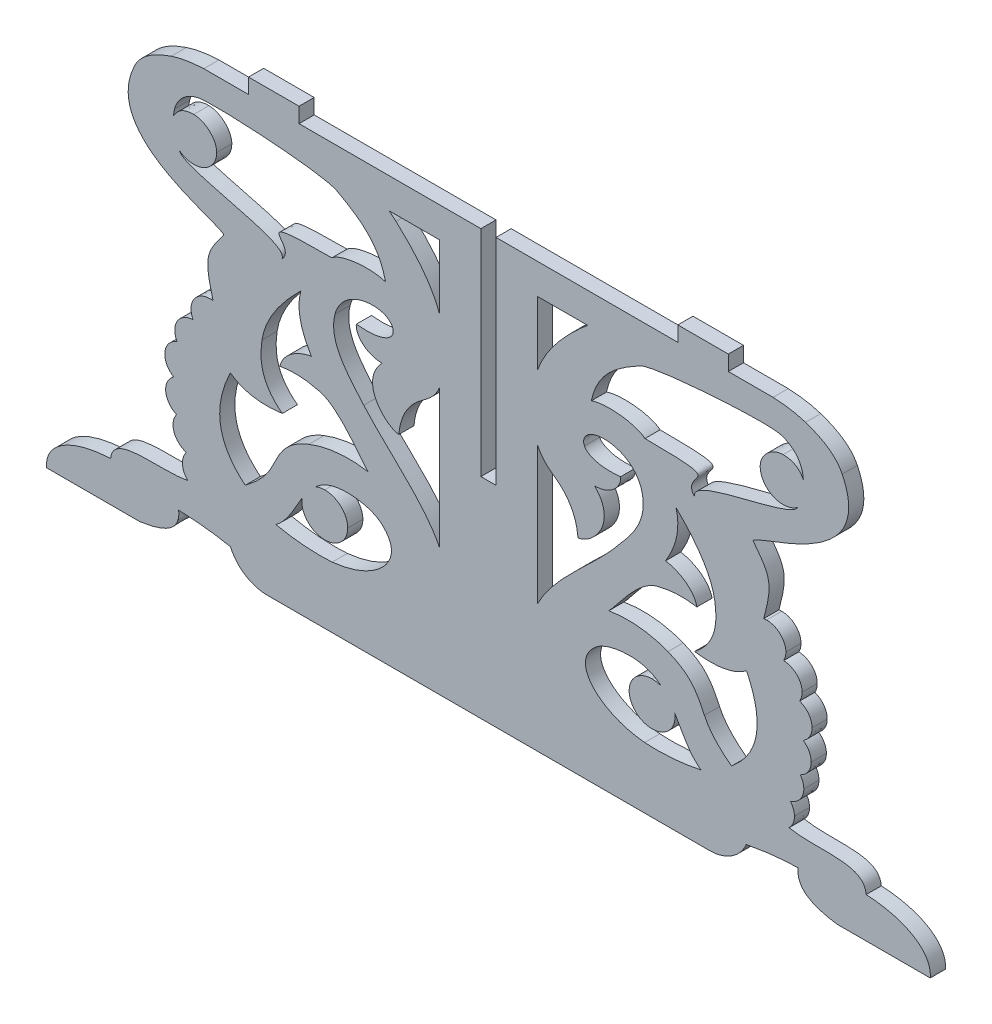
from build123d import *

# Parameters (mm, degrees)
RESSALTO_EXTRUS_O1_DEPTH = 2


with BuildPart() as part:
    # Model → Ressalto-extrusão1 (new body)
    with BuildSketch(Plane.XY):
        with BuildLine():
            Line((-58.0295, -71.5532), (-45.7155, -71.5532))
            add(Edge.make_bspline(
                [(-45.7155, -71.5532), (-42.3585, -71.0822), (-40.3248, -69.9761), (-40.6026, -67.6718)],
                knots=[0.327868852, 0.327868852, 0.327868852, 0.327868852, 0.344262295, 0.344262295, 0.344262295, 0.344262295], degree=3))
            add(Edge.make_bspline(
                [(-40.6026, -67.6718), (-37.8869, -67.763), (-35.6926, -68.0475), (-33.7519, -68.4372)],
                knots=[0.344262295, 0.344262295, 0.344262295, 0.344262295, 0.360655738, 0.360655738, 0.360655738, 0.360655738], degree=3))
            add(Edge.make_bspline(
                [(-33.7519, -68.4372), (-32.9718, -70.2591), (-31.0759, -71.5532), (-28.8751, -71.5532)],
                knots=[0.360655738, 0.360655738, 0.360655738, 0.360655738, 0.37704918, 0.37704918, 0.37704918, 0.37704918], degree=3))
            add(Edge.make_bspline(
                [(-28.8751, -71.5532), (-9.4317, -71.5532), (10.0118, -71.5532), (29.4553, -71.5532)],
                knots=[0.37704918, 0.37704918, 0.37704918, 0.37704918, 0.393442623, 0.393442623, 0.393442623, 0.393442623], degree=3))
            add(Edge.make_bspline(
                [(29.4553, -71.5532), (31.6561, -71.5532), (33.552, -70.2591), (34.3321, -68.4372)],
                knots=[0.393442623, 0.393442623, 0.393442623, 0.393442623, 0.409836066, 0.409836066, 0.409836066, 0.409836066], degree=3))
            add(Edge.make_bspline(
                [(34.3321, -68.4372), (36.2728, -68.0475), (38.4671, -67.763), (41.1827, -67.6718)],
                knots=[0.409836066, 0.409836066, 0.409836066, 0.409836066, 0.426229508, 0.426229508, 0.426229508, 0.426229508], degree=3))
            add(Edge.make_bspline(
                [(41.1827, -67.6718), (40.905, -69.9761), (42.9386, -71.0822), (46.2957, -71.5532)],
                knots=[0.426229508, 0.426229508, 0.426229508, 0.426229508, 0.442622951, 0.442622951, 0.442622951, 0.442622951], degree=3))
            Line((46.2957, -71.5532), (58.6097, -71.5532))
            add(Edge.make_bspline(
                [(58.6097, -71.5532), (58.8625, -68.7212), (55.5947, -66.5289), (50.1481, -66.2516)],
                knots=[0.459016393, 0.459016393, 0.459016393, 0.459016393, 0.475409836, 0.475409836, 0.475409836, 0.475409836], degree=3))
            add(Edge.make_bspline(
                [(50.1481, -66.2516), (49.8687, -62.8619), (43.6771, -64.4482), (39.976, -63.6903)],
                knots=[0.475409836, 0.475409836, 0.475409836, 0.475409836, 0.491803279, 0.491803279, 0.491803279, 0.491803279], degree=3))
            add(Edge.make_bspline(
                [(39.976, -63.6903), (40.4117, -63.2593), (40.6794, -62.6755), (40.6794, -62.0328)],
                knots=[0.491803279, 0.491803279, 0.491803279, 0.491803279, 0.508196721, 0.508196721, 0.508196721, 0.508196721], degree=3))
            add(Edge.make_bspline(
                [(40.6794, -62.0328), (40.6794, -61.4833), (40.4836, -60.9769), (40.1546, -60.5722)],
                knots=[0.508196721, 0.508196721, 0.508196721, 0.508196721, 0.524590164, 0.524590164, 0.524590164, 0.524590164], degree=3))
            add(Edge.make_bspline(
                [(40.1546, -60.5722), (41.1789, -60.2622), (41.9209, -59.3557), (41.9209, -58.2855)],
                knots=[0.524590164, 0.524590164, 0.524590164, 0.524590164, 0.540983607, 0.540983607, 0.540983607, 0.540983607], degree=3))
            add(Edge.make_bspline(
                [(41.9209, -58.2855), (41.9209, -57.7691), (41.748, -57.2907), (41.4541, -56.899)],
                knots=[0.540983607, 0.540983607, 0.540983607, 0.540983607, 0.557377049, 0.557377049, 0.557377049, 0.557377049], degree=3))
            add(Edge.make_bspline(
                [(41.4541, -56.899), (42.3085, -56.5121), (42.8989, -55.6878), (42.8989, -54.7333)],
                knots=[0.557377049, 0.557377049, 0.557377049, 0.557377049, 0.573770492, 0.573770492, 0.573770492, 0.573770492], degree=3))
            add(Edge.make_bspline(
                [(42.8989, -54.7333), (42.8989, -53.9284), (42.4789, -53.2156), (41.8349, -52.78)],
                knots=[0.573770492, 0.573770492, 0.573770492, 0.573770492, 0.590163934, 0.590163934, 0.590163934, 0.590163934], degree=3))
            add(Edge.make_bspline(
                [(41.8349, -52.78), (42.5423, -52.3535), (43.0118, -51.6062), (43.0118, -50.755)],
                knots=[0.590163934, 0.590163934, 0.590163934, 0.590163934, 0.606557377, 0.606557377, 0.606557377, 0.606557377], degree=3))
            add(Edge.make_bspline(
                [(43.0118, -50.755), (43.0118, -49.7306), (42.3319, -48.856), (41.3753, -48.5111)],
                knots=[0.606557377, 0.606557377, 0.606557377, 0.606557377, 0.62295082, 0.62295082, 0.62295082, 0.62295082], degree=3))
            add(Edge.make_bspline(
                [(41.3753, -48.5111), (41.5791, -48.1658), (41.6954, -47.7683), (41.6954, -47.3449)],
                knots=[0.62295082, 0.62295082, 0.62295082, 0.62295082, 0.639344262, 0.639344262, 0.639344262, 0.639344262], degree=3))
            add(Edge.make_bspline(
                [(41.6954, -47.3449), (41.6954, -46.0535), (40.6149, -44.9999), (39.2612, -44.9462)],
                knots=[0.639344262, 0.639344262, 0.639344262, 0.639344262, 0.655737705, 0.655737705, 0.655737705, 0.655737705], degree=3))
            add(Edge.make_bspline(
                [(39.2612, -44.9462), (39.447, -44.6128), (39.5524, -44.2332), (39.5524, -43.8303)],
                knots=[0.655737705, 0.655737705, 0.655737705, 0.655737705, 0.672131148, 0.672131148, 0.672131148, 0.672131148], degree=3))
            add(Edge.make_bspline(
                [(39.5524, -43.8303), (39.5524, -42.5045), (38.4138, -41.4292), (37.0097, -41.4292)],
                knots=[0.672131148, 0.672131148, 0.672131148, 0.672131148, 0.68852459, 0.68852459, 0.68852459, 0.68852459], degree=3))
            add(Edge.make_bspline(
                [(37.0097, -41.4292), (36.8829, -41.4292), (36.7582, -41.4381), (36.6363, -41.4551)],
                knots=[0.68852459, 0.68852459, 0.68852459, 0.68852459, 0.704918033, 0.704918033, 0.704918033, 0.704918033], degree=3))
            add(Edge.make_bspline(
                [(36.6363, -41.4551), (37.8897, -36.8147), (37.477, -36.2087), (35.2126, -33.2356)],
                knots=[0.704918033, 0.704918033, 0.704918033, 0.704918033, 0.721311475, 0.721311475, 0.721311475, 0.721311475], degree=3))
            add(Edge.make_bspline(
                [(35.2126, -33.2356), (36.2749, -31.9971), (51.5777, -29.2085), (46.9881, -19.7647)],
                knots=[0.721311475, 0.721311475, 0.721311475, 0.721311475, 0.737704918, 0.737704918, 0.737704918, 0.737704918], degree=3))
            add(Edge.make_bspline(
                [(46.9881, -19.7647), (46.322, -18.394), (44.8758, -17.1731), (42.1528, -16.2641)],
                knots=[0.737704918, 0.737704918, 0.737704918, 0.737704918, 0.754098361, 0.754098361, 0.754098361, 0.754098361], degree=3))
            add(Edge.make_bspline(
                [(42.1528, -16.2641), (40.9147, -15.8508), (39.4354, -15.6137), (37.859, -15.5493)],
                knots=[0.754098361, 0.754098361, 0.754098361, 0.754098361, 0.770491803, 0.770491803, 0.770491803, 0.770491803], degree=3))
            Line((37.859, -15.5493), (31.9567, -15.5493))
            Line((31.9567, -15.5493), (31.9567, -13.5542))
            Line((31.9567, -13.5542), (25.2901, -13.5542))
            Line((25.2901, -13.5542), (25.2901, -15.5493))
            Line((25.2901, -15.5493), (1.2901, -15.5493))
            Line((1.2901, -15.5493), (1.2901, -43.8921))
            Line((1.2901, -43.8921), (-0.7099, -43.8921))
            Line((-0.7099, -43.8921), (-0.7099, -15.5493))
            Line((-0.7099, -15.5493), (-24.7099, -15.5493))
            Line((-24.7099, -15.5493), (-24.7099, -13.5542))
            Line((-24.7099, -13.5542), (-31.3766, -13.5542))
            Line((-31.3766, -13.5542), (-31.3766, -15.5493))
            Line((-31.3766, -15.5493), (-37.2789, -15.5493))
            add(Edge.make_bspline(
                [(-37.2789, -15.5493), (-38.8553, -15.6137), (-40.3345, -15.8508), (-41.5726, -16.2641)],
                knots=[0, 0, 0, 0, 0.016393443, 0.016393443, 0.016393443, 0.016393443], degree=3))
            add(Edge.make_bspline(
                [(-41.5726, -16.2641), (-44.2957, -17.1731), (-45.7419, -18.394), (-46.408, -19.7647)],
                knots=[0.016393443, 0.016393443, 0.016393443, 0.016393443, 0.032786885, 0.032786885, 0.032786885, 0.032786885], degree=3))
            add(Edge.make_bspline(
                [(-46.408, -19.7647), (-50.9976, -29.2085), (-35.6947, -31.9971), (-34.6325, -33.2356)],
                knots=[0.032786885, 0.032786885, 0.032786885, 0.032786885, 0.049180328, 0.049180328, 0.049180328, 0.049180328], degree=3))
            add(Edge.make_bspline(
                [(-34.6325, -33.2356), (-36.8968, -36.2087), (-37.3095, -36.8147), (-36.0561, -41.4551)],
                knots=[0.049180328, 0.049180328, 0.049180328, 0.049180328, 0.06557377, 0.06557377, 0.06557377, 0.06557377], degree=3))
            add(Edge.make_bspline(
                [(-36.0561, -41.4551), (-36.178, -41.4381), (-36.3027, -41.4292), (-36.4296, -41.4292)],
                knots=[0.06557377, 0.06557377, 0.06557377, 0.06557377, 0.081967213, 0.081967213, 0.081967213, 0.081967213], degree=3))
            add(Edge.make_bspline(
                [(-36.4296, -41.4292), (-37.8337, -41.4292), (-38.9723, -42.5045), (-38.9723, -43.8303)],
                knots=[0.081967213, 0.081967213, 0.081967213, 0.081967213, 0.098360656, 0.098360656, 0.098360656, 0.098360656], degree=3))
            add(Edge.make_bspline(
                [(-38.9723, -43.8303), (-38.9723, -44.2332), (-38.8669, -44.6128), (-38.681, -44.9462)],
                knots=[0.098360656, 0.098360656, 0.098360656, 0.098360656, 0.114754098, 0.114754098, 0.114754098, 0.114754098], degree=3))
            add(Edge.make_bspline(
                [(-38.681, -44.9462), (-40.0347, -44.9999), (-41.1152, -46.0535), (-41.1152, -47.3449)],
                knots=[0.114754098, 0.114754098, 0.114754098, 0.114754098, 0.131147541, 0.131147541, 0.131147541, 0.131147541], degree=3))
            add(Edge.make_bspline(
                [(-41.1152, -47.3449), (-41.1152, -47.7683), (-40.9989, -48.1658), (-40.7951, -48.5111)],
                knots=[0.131147541, 0.131147541, 0.131147541, 0.131147541, 0.147540984, 0.147540984, 0.147540984, 0.147540984], degree=3))
            add(Edge.make_bspline(
                [(-40.7951, -48.5111), (-41.7518, -48.856), (-42.4316, -49.7306), (-42.4316, -50.755)],
                knots=[0.147540984, 0.147540984, 0.147540984, 0.147540984, 0.163934426, 0.163934426, 0.163934426, 0.163934426], degree=3))
            add(Edge.make_bspline(
                [(-42.4316, -50.755), (-42.4316, -51.6062), (-41.9621, -52.3535), (-41.2547, -52.78)],
                knots=[0.163934426, 0.163934426, 0.163934426, 0.163934426, 0.180327869, 0.180327869, 0.180327869, 0.180327869], degree=3))
            add(Edge.make_bspline(
                [(-41.2547, -52.78), (-41.8988, -53.2156), (-42.3188, -53.9284), (-42.3188, -54.7333)],
                knots=[0.180327869, 0.180327869, 0.180327869, 0.180327869, 0.196721311, 0.196721311, 0.196721311, 0.196721311], degree=3))
            add(Edge.make_bspline(
                [(-42.3188, -54.7333), (-42.3188, -55.6878), (-41.7284, -56.5121), (-40.874, -56.899)],
                knots=[0.196721311, 0.196721311, 0.196721311, 0.196721311, 0.213114754, 0.213114754, 0.213114754, 0.213114754], degree=3))
            add(Edge.make_bspline(
                [(-40.874, -56.899), (-41.1678, -57.2907), (-41.3407, -57.7691), (-41.3407, -58.2855)],
                knots=[0.213114754, 0.213114754, 0.213114754, 0.213114754, 0.229508197, 0.229508197, 0.229508197, 0.229508197], degree=3))
            add(Edge.make_bspline(
                [(-41.3407, -58.2855), (-41.3407, -59.3557), (-40.5988, -60.2622), (-39.5745, -60.5722)],
                knots=[0.229508197, 0.229508197, 0.229508197, 0.229508197, 0.245901639, 0.245901639, 0.245901639, 0.245901639], degree=3))
            add(Edge.make_bspline(
                [(-39.5745, -60.5722), (-39.9035, -60.9769), (-40.0993, -61.4833), (-40.0993, -62.0328)],
                knots=[0.245901639, 0.245901639, 0.245901639, 0.245901639, 0.262295082, 0.262295082, 0.262295082, 0.262295082], degree=3))
            add(Edge.make_bspline(
                [(-40.0993, -62.0328), (-40.0993, -62.6755), (-39.8315, -63.2593), (-39.3959, -63.6903)],
                knots=[0.262295082, 0.262295082, 0.262295082, 0.262295082, 0.278688525, 0.278688525, 0.278688525, 0.278688525], degree=3))
            add(Edge.make_bspline(
                [(-39.3959, -63.6903), (-43.0969, -64.4482), (-49.2885, -62.8619), (-49.5679, -66.2516)],
                knots=[0.278688525, 0.278688525, 0.278688525, 0.278688525, 0.295081967, 0.295081967, 0.295081967, 0.295081967], degree=3))
            add(Edge.make_bspline(
                [(-49.5679, -66.2516), (-55.0145, -66.5289), (-58.2823, -68.7212), (-58.0295, -71.5532)],
                knots=[0.295081967, 0.295081967, 0.295081967, 0.295081967, 0.31147541, 0.31147541, 0.31147541, 0.31147541], degree=3))
        make_face()
        with BuildLine():
            Line((41.8464, -22.9309), (41.8509, -22.9067))
            add(Edge.make_bspline(
                [(41.8509, -22.9067), (41.8313, -22.6217), (41.7887, -22.3443), (41.7202, -22.0779)],
                knots=[0.357142857, 0.357142857, 0.357142857, 0.357142857, 0.428571429, 0.428571429, 0.428571429, 0.428571429], degree=3))
            add(Edge.make_bspline(
                [(41.7202, -22.0779), (41.4272, -20.9402), (40.448, -19.6292), (38.5962, -19.2465)],
                knots=[0.428571429, 0.428571429, 0.428571429, 0.428571429, 0.5, 0.5, 0.5, 0.5], degree=3))
            add(Edge.make_bspline(
                [(38.5962, -19.2465), (36.406, -18.7935), (22.1887, -19.664), (20.2699, -20.7424)],
                knots=[0.5, 0.5, 0.5, 0.5, 0.571428571, 0.571428571, 0.571428571, 0.571428571], degree=3))
            add(Edge.make_bspline(
                [(20.2699, -20.7424), (17.8156, -22.1218), (14.7391, -23.8156), (13.8733, -27.9378)],
                knots=[0.571428571, 0.571428571, 0.571428571, 0.571428571, 0.642857143, 0.642857143, 0.642857143, 0.642857143], degree=3))
            add(Edge.make_bspline(
                [(13.8733, -27.9378), (15.6554, -27.278), (19.6405, -27.5829), (20.951, -28.7164)],
                knots=[0.642857143, 0.642857143, 0.642857143, 0.642857143, 0.714285714, 0.714285714, 0.714285714, 0.714285714], degree=3))
            add(Edge.make_bspline(
                [(20.951, -28.7164), (32.8615, -28.7164), (25.4889, -29.6957), (27.4601, -32.0549)],
                knots=[0.714285714, 0.714285714, 0.714285714, 0.714285714, 0.785714286, 0.785714286, 0.785714286, 0.785714286], degree=3))
            Line((27.4601, -32.0549), (27.5114, -32.0551))
            add(Edge.make_bspline(
                [(27.5114, -32.0551), (26.8882, -29.8021), (40.2299, -28.4327), (41.0991, -26.5055)],
                knots=[0.857142857, 0.857142857, 0.857142857, 0.857142857, 1, 1, 1, 1], degree=3))
            add(Edge.make_bspline(
                [(41.0991, -26.5055), (40.5779, -26.9077), (39.9123, -27.1488), (39.1869, -27.1489)],
                knots=[0, 0, 0, 0, 0.071428571, 0.071428571, 0.071428571, 0.071428571], degree=3))
            add(Edge.make_bspline(
                [(39.1869, -27.1489), (37.5166, -27.1488), (36.162, -25.8701), (36.162, -24.2928)],
                knots=[0.071428571, 0.071428571, 0.071428571, 0.071428571, 0.142857143, 0.142857143, 0.142857143, 0.142857143], degree=3))
            add(Edge.make_bspline(
                [(36.162, -24.2928), (36.162, -22.7154), (37.7777, -21.4359), (39.1869, -21.4359)],
                knots=[0.142857143, 0.142857143, 0.142857143, 0.142857143, 0.214285714, 0.214285714, 0.214285714, 0.214285714], degree=3))
            add(Edge.make_bspline(
                [(39.1869, -21.4359), (40.5962, -21.4359), (41.3341, -22.0405), (41.8464, -22.9309)],
                knots=[0.214285714, 0.214285714, 0.214285714, 0.214285714, 0.285714286, 0.285714286, 0.285714286, 0.285714286], degree=3))
        make_face(mode=Mode.SUBTRACT)
        with BuildLine():
            Line((6.7678, -54.6917), (6.7678, -36.4907))
            add(Edge.make_bspline(
                [(6.7678, -36.4907), (7.1177, -37.3515), (7.7821, -38.1712), (8.8217, -38.8882)],
                knots=[0.083333333, 0.083333333, 0.083333333, 0.083333333, 0.166666667, 0.166666667, 0.166666667, 0.166666667], degree=3))
            add(Edge.make_bspline(
                [(8.8217, -38.8882), (10.4062, -39.9811), (11.8709, -41.6153), (12.1135, -44.4942)],
                knots=[0.166666667, 0.166666667, 0.166666667, 0.166666667, 0.25, 0.25, 0.25, 0.25], degree=3))
            add(Edge.make_bspline(
                [(12.1135, -44.4942), (14.0789, -44.2506), (17.4305, -40.5964), (14.3074, -37.4419)],
                knots=[0.25, 0.25, 0.25, 0.25, 0.333333333, 0.333333333, 0.333333333, 0.333333333], degree=3))
            add(Edge.make_bspline(
                [(14.3074, -37.4419), (16.2667, -37.4909), (17.8601, -36.0383), (17.7312, -34.6895)],
                knots=[0.333333333, 0.333333333, 0.333333333, 0.333333333, 0.416666667, 0.416666667, 0.416666667, 0.416666667], degree=3))
            add(Edge.make_bspline(
                [(17.7312, -34.6895), (14.9058, -34.9858), (13.3648, -34.3445), (12.9675, -33.5507)],
                knots=[0.416666667, 0.416666667, 0.416666667, 0.416666667, 0.5, 0.5, 0.5, 0.5], degree=3))
            add(Edge.make_bspline(
                [(12.9675, -33.5507), (12.7751, -33.1662), (12.8359, -32.7459), (13.1165, -32.3713)],
                knots=[0.5, 0.5, 0.5, 0.5, 0.583333333, 0.583333333, 0.583333333, 0.583333333], degree=3))
            add(Edge.make_bspline(
                [(13.1165, -32.3713), (13.9625, -31.2424), (16.199, -31.233), (17.7583, -31.8726)],
                knots=[0.583333333, 0.583333333, 0.583333333, 0.583333333, 0.666666667, 0.666666667, 0.666666667, 0.666666667], degree=3))
            add(Edge.make_bspline(
                [(17.7583, -31.8726), (19.301, -32.5053), (20.2207, -33.6838), (20.5427, -34.9484)],
                knots=[0.666666667, 0.666666667, 0.666666667, 0.666666667, 0.75, 0.75, 0.75, 0.75], degree=3))
            add(Edge.make_bspline(
                [(20.5427, -34.9484), (21.4025, -38.3248), (19.0104, -40.8664), (16.7475, -43.4634)],
                knots=[0.75, 0.75, 0.75, 0.75, 0.833333333, 0.833333333, 0.833333333, 0.833333333], degree=3))
            add(Edge.make_bspline(
                [(16.7475, -43.4634), (13.6063, -47.0685), (8.8067, -50.5847), (6.7678, -54.6917)],
                knots=[0.833333333, 0.833333333, 0.833333333, 0.833333333, 1, 1, 1, 1], degree=3))
        make_face(mode=Mode.SUBTRACT)
        with BuildLine():
            Line((25.2636, -34.7621), (25.2605, -34.7639))
            Line((25.2605, -34.7639), (25.2233, -34.7226))
            add(Edge.make_bspline(
                [(25.2233, -34.7226), (25.1662, -34.6668), (25.1087, -34.611), (25.0509, -34.555)],
                knots=[0.133333333, 0.133333333, 0.133333333, 0.133333333, 0.2, 0.2, 0.2, 0.2], degree=3))
            add(Edge.make_bspline(
                [(25.0509, -34.555), (25.6852, -36.9016), (25.0055, -39.1271), (23.6733, -41.332)],
                knots=[0.2, 0.2, 0.2, 0.2, 0.266666667, 0.266666667, 0.266666667, 0.266666667], degree=3))
            add(Edge.make_bspline(
                [(23.6733, -41.332), (25.5011, -41.6329), (27.4577, -42.8346), (27.8065, -44.5414)],
                knots=[0.266666667, 0.266666667, 0.266666667, 0.266666667, 0.333333333, 0.333333333, 0.333333333, 0.333333333], degree=3))
            add(Edge.make_bspline(
                [(27.8065, -44.5414), (26.0758, -44.234), (24.4417, -44.3248), (22.61, -44.7856)],
                knots=[0.333333333, 0.333333333, 0.333333333, 0.333333333, 0.4, 0.4, 0.4, 0.4], degree=3))
            add(Edge.make_bspline(
                [(22.61, -44.7856), (19.945, -45.4561), (17.4208, -49.5455), (16.1735, -50.7932)],
                knots=[0.4, 0.4, 0.4, 0.4, 0.466666667, 0.466666667, 0.466666667, 0.466666667], degree=3))
            add(Edge.make_bspline(
                [(16.1735, -50.7932), (19.0564, -50.2753), (21.8473, -50.7043), (23.993, -51.5534)],
                knots=[0.466666667, 0.466666667, 0.466666667, 0.466666667, 0.533333333, 0.533333333, 0.533333333, 0.533333333], degree=3))
            add(Edge.make_bspline(
                [(23.993, -51.5534), (27.0207, -52.7513), (27.8131, -54.3528), (28.7997, -56.4207)],
                knots=[0.533333333, 0.533333333, 0.533333333, 0.533333333, 0.6, 0.6, 0.6, 0.6], degree=3))
            add(Edge.make_bspline(
                [(28.7997, -56.4207), (29.3141, -57.4989), (30.133, -58.7455), (32.3886, -60.4342)],
                knots=[0.6, 0.6, 0.6, 0.6, 0.666666667, 0.666666667, 0.666666667, 0.666666667], degree=3))
            add(Edge.make_bspline(
                [(32.3886, -60.4342), (35.742, -57.6622), (36.9574, -53.9478), (34.3619, -48.5537)],
                knots=[0.666666667, 0.666666667, 0.666666667, 0.666666667, 0.733333333, 0.733333333, 0.733333333, 0.733333333], degree=3))
            add(Edge.make_bspline(
                [(34.3619, -48.5537), (32.6868, -49.8379), (30.2026, -50.1725), (27.4986, -49.7829)],
                knots=[0.733333333, 0.733333333, 0.733333333, 0.733333333, 0.8, 0.8, 0.8, 0.8], degree=3))
            add(Edge.make_bspline(
                [(27.4986, -49.7829), (30.2732, -47.6893), (30.5616, -45.1772), (30.1795, -42.7182)],
                knots=[0.8, 0.8, 0.8, 0.8, 0.866666667, 0.866666667, 0.866666667, 0.866666667], degree=3))
            add(Edge.make_bspline(
                [(30.1795, -42.7182), (29.7867, -40.1904), (28.096, -37.5453), (25.2636, -34.7621)],
                knots=[0.866666667, 0.866666667, 0.866666667, 0.866666667, 1, 1, 1, 1], degree=3))
        make_face(mode=Mode.SUBTRACT)
        with BuildLine():
            Line((6.7678, -27.9915), (6.7678, -19.5605))
            Line((6.7678, -19.5605), (13.3925, -19.5605))
            add(Edge.make_bspline(
                [(13.3925, -19.5605), (13.0822, -19.8065), (12.7813, -20.0607), (12.4899, -20.3228)],
                knots=[0.4, 0.4, 0.4, 0.4, 0.6, 0.6, 0.6, 0.6], degree=3))
            add(Edge.make_bspline(
                [(12.4899, -20.3228), (9.9255, -22.6296), (7.6953, -25.2917), (6.7678, -27.9915)],
                knots=[0.6, 0.6, 0.6, 0.6, 1, 1, 1, 1], degree=3))
        make_face(mode=Mode.SUBTRACT)
        with BuildLine():
            Line((-41.2663, -22.9309), (-41.2707, -22.9067))
            add(Edge.make_bspline(
                [(-41.2707, -22.9067), (-41.2511, -22.6217), (-41.2086, -22.3443), (-41.14, -22.0779)],
                knots=[0.357142857, 0.357142857, 0.357142857, 0.357142857, 0.428571429, 0.428571429, 0.428571429, 0.428571429], degree=3))
            add(Edge.make_bspline(
                [(-41.14, -22.0779), (-40.847, -20.9402), (-39.8679, -19.6292), (-38.0161, -19.2465)],
                knots=[0.428571429, 0.428571429, 0.428571429, 0.428571429, 0.5, 0.5, 0.5, 0.5], degree=3))
            add(Edge.make_bspline(
                [(-38.0161, -19.2465), (-35.8259, -18.7935), (-21.6086, -19.664), (-19.6898, -20.7424)],
                knots=[0.5, 0.5, 0.5, 0.5, 0.571428571, 0.571428571, 0.571428571, 0.571428571], degree=3))
            add(Edge.make_bspline(
                [(-19.6898, -20.7424), (-17.2355, -22.1218), (-14.1589, -23.8156), (-13.2931, -27.9378)],
                knots=[0.571428571, 0.571428571, 0.571428571, 0.571428571, 0.642857143, 0.642857143, 0.642857143, 0.642857143], degree=3))
            add(Edge.make_bspline(
                [(-13.2931, -27.9378), (-15.0753, -27.278), (-19.0603, -27.5829), (-20.3708, -28.7164)],
                knots=[0.642857143, 0.642857143, 0.642857143, 0.642857143, 0.714285714, 0.714285714, 0.714285714, 0.714285714], degree=3))
            add(Edge.make_bspline(
                [(-20.3708, -28.7164), (-32.2813, -28.7164), (-24.9088, -29.6957), (-26.8799, -32.0549)],
                knots=[0.714285714, 0.714285714, 0.714285714, 0.714285714, 0.785714286, 0.785714286, 0.785714286, 0.785714286], degree=3))
            Line((-26.8799, -32.0549), (-26.9313, -32.0551))
            add(Edge.make_bspline(
                [(-26.9313, -32.0551), (-26.308, -29.8021), (-39.6497, -28.4327), (-40.5189, -26.5055)],
                knots=[0.857142857, 0.857142857, 0.857142857, 0.857142857, 1, 1, 1, 1], degree=3))
            add(Edge.make_bspline(
                [(-40.5189, -26.5055), (-39.9977, -26.9077), (-39.3321, -27.1488), (-38.6068, -27.1489)],
                knots=[0, 0, 0, 0, 0.071428571, 0.071428571, 0.071428571, 0.071428571], degree=3))
            add(Edge.make_bspline(
                [(-38.6068, -27.1489), (-36.9365, -27.1488), (-35.5819, -25.8701), (-35.5819, -24.2928)],
                knots=[0.071428571, 0.071428571, 0.071428571, 0.071428571, 0.142857143, 0.142857143, 0.142857143, 0.142857143], degree=3))
            add(Edge.make_bspline(
                [(-35.5819, -24.2928), (-35.5819, -22.7154), (-37.1975, -21.4359), (-38.6068, -21.4359)],
                knots=[0.142857143, 0.142857143, 0.142857143, 0.142857143, 0.214285714, 0.214285714, 0.214285714, 0.214285714], degree=3))
            add(Edge.make_bspline(
                [(-38.6068, -21.4359), (-40.016, -21.4359), (-40.754, -22.0405), (-41.2663, -22.9309)],
                knots=[0.214285714, 0.214285714, 0.214285714, 0.214285714, 0.285714286, 0.285714286, 0.285714286, 0.285714286], degree=3))
        make_face(mode=Mode.SUBTRACT)
        with BuildLine():
            Line((-6.1877, -54.6917), (-6.1877, -36.4907))
            add(Edge.make_bspline(
                [(-6.1877, -36.4907), (-6.5375, -37.3515), (-7.202, -38.1712), (-8.2415, -38.8882)],
                knots=[0.083333333, 0.083333333, 0.083333333, 0.083333333, 0.166666667, 0.166666667, 0.166666667, 0.166666667], degree=3))
            add(Edge.make_bspline(
                [(-8.2415, -38.8882), (-9.826, -39.9811), (-11.2907, -41.6153), (-11.5334, -44.4942)],
                knots=[0.166666667, 0.166666667, 0.166666667, 0.166666667, 0.25, 0.25, 0.25, 0.25], degree=3))
            add(Edge.make_bspline(
                [(-11.5334, -44.4942), (-13.4988, -44.2506), (-16.8504, -40.5964), (-13.7272, -37.4419)],
                knots=[0.25, 0.25, 0.25, 0.25, 0.333333333, 0.333333333, 0.333333333, 0.333333333], degree=3))
            add(Edge.make_bspline(
                [(-13.7272, -37.4419), (-15.6865, -37.4909), (-17.2799, -36.0383), (-17.151, -34.6895)],
                knots=[0.333333333, 0.333333333, 0.333333333, 0.333333333, 0.416666667, 0.416666667, 0.416666667, 0.416666667], degree=3))
            add(Edge.make_bspline(
                [(-17.151, -34.6895), (-14.3257, -34.9858), (-12.7846, -34.3445), (-12.3874, -33.5507)],
                knots=[0.416666667, 0.416666667, 0.416666667, 0.416666667, 0.5, 0.5, 0.5, 0.5], degree=3))
            add(Edge.make_bspline(
                [(-12.3874, -33.5507), (-12.195, -33.1662), (-12.2557, -32.7459), (-12.5364, -32.3713)],
                knots=[0.5, 0.5, 0.5, 0.5, 0.583333333, 0.583333333, 0.583333333, 0.583333333], degree=3))
            add(Edge.make_bspline(
                [(-12.5364, -32.3713), (-13.3823, -31.2424), (-15.6188, -31.233), (-17.1782, -31.8726)],
                knots=[0.583333333, 0.583333333, 0.583333333, 0.583333333, 0.666666667, 0.666666667, 0.666666667, 0.666666667], degree=3))
            add(Edge.make_bspline(
                [(-17.1782, -31.8726), (-18.7209, -32.5053), (-19.6406, -33.6838), (-19.9625, -34.9484)],
                knots=[0.666666667, 0.666666667, 0.666666667, 0.666666667, 0.75, 0.75, 0.75, 0.75], degree=3))
            add(Edge.make_bspline(
                [(-19.9625, -34.9484), (-20.8224, -38.3248), (-18.4302, -40.8664), (-16.1674, -43.4634)],
                knots=[0.75, 0.75, 0.75, 0.75, 0.833333333, 0.833333333, 0.833333333, 0.833333333], degree=3))
            add(Edge.make_bspline(
                [(-16.1674, -43.4634), (-13.0261, -47.0685), (-8.2265, -50.5847), (-6.1877, -54.6917)],
                knots=[0.833333333, 0.833333333, 0.833333333, 0.833333333, 1, 1, 1, 1], degree=3))
        make_face(mode=Mode.SUBTRACT)
        with BuildLine():
            Line((-24.6834, -34.7621), (-24.6804, -34.7639))
            Line((-24.6804, -34.7639), (-24.6431, -34.7226))
            add(Edge.make_bspline(
                [(-24.6431, -34.7226), (-24.5861, -34.6668), (-24.5286, -34.611), (-24.4707, -34.555)],
                knots=[0.133333333, 0.133333333, 0.133333333, 0.133333333, 0.2, 0.2, 0.2, 0.2], degree=3))
            add(Edge.make_bspline(
                [(-24.4707, -34.555), (-25.105, -36.9016), (-24.4253, -39.1271), (-23.0931, -41.332)],
                knots=[0.2, 0.2, 0.2, 0.2, 0.266666667, 0.266666667, 0.266666667, 0.266666667], degree=3))
            add(Edge.make_bspline(
                [(-23.0931, -41.332), (-24.921, -41.6329), (-26.8776, -42.8346), (-27.2264, -44.5414)],
                knots=[0.266666667, 0.266666667, 0.266666667, 0.266666667, 0.333333333, 0.333333333, 0.333333333, 0.333333333], degree=3))
            add(Edge.make_bspline(
                [(-27.2264, -44.5414), (-25.4957, -44.234), (-23.8615, -44.3248), (-22.0299, -44.7856)],
                knots=[0.333333333, 0.333333333, 0.333333333, 0.333333333, 0.4, 0.4, 0.4, 0.4], degree=3))
            add(Edge.make_bspline(
                [(-22.0299, -44.7856), (-19.3648, -45.4561), (-16.8406, -49.5455), (-15.5933, -50.7932)],
                knots=[0.4, 0.4, 0.4, 0.4, 0.466666667, 0.466666667, 0.466666667, 0.466666667], degree=3))
            add(Edge.make_bspline(
                [(-15.5933, -50.7932), (-18.4762, -50.2753), (-21.2671, -50.7043), (-23.4129, -51.5534)],
                knots=[0.466666667, 0.466666667, 0.466666667, 0.466666667, 0.533333333, 0.533333333, 0.533333333, 0.533333333], degree=3))
            add(Edge.make_bspline(
                [(-23.4129, -51.5534), (-26.4406, -52.7513), (-27.233, -54.3528), (-28.2196, -56.4207)],
                knots=[0.533333333, 0.533333333, 0.533333333, 0.533333333, 0.6, 0.6, 0.6, 0.6], degree=3))
            add(Edge.make_bspline(
                [(-28.2196, -56.4207), (-28.734, -57.4989), (-29.5528, -58.7455), (-31.8084, -60.4342)],
                knots=[0.6, 0.6, 0.6, 0.6, 0.666666667, 0.666666667, 0.666666667, 0.666666667], degree=3))
            add(Edge.make_bspline(
                [(-31.8084, -60.4342), (-35.1618, -57.6622), (-36.3773, -53.9478), (-33.7818, -48.5537)],
                knots=[0.666666667, 0.666666667, 0.666666667, 0.666666667, 0.733333333, 0.733333333, 0.733333333, 0.733333333], degree=3))
            add(Edge.make_bspline(
                [(-33.7818, -48.5537), (-32.1066, -49.8379), (-29.6224, -50.1725), (-26.9184, -49.7829)],
                knots=[0.733333333, 0.733333333, 0.733333333, 0.733333333, 0.8, 0.8, 0.8, 0.8], degree=3))
            add(Edge.make_bspline(
                [(-26.9184, -49.7829), (-29.693, -47.6893), (-29.9814, -45.1772), (-29.5994, -42.7182)],
                knots=[0.8, 0.8, 0.8, 0.8, 0.866666667, 0.866666667, 0.866666667, 0.866666667], degree=3))
            add(Edge.make_bspline(
                [(-29.5994, -42.7182), (-29.2066, -40.1904), (-27.5159, -37.5453), (-24.6834, -34.7621)],
                knots=[0.866666667, 0.866666667, 0.866666667, 0.866666667, 1, 1, 1, 1], degree=3))
        make_face(mode=Mode.SUBTRACT)
        with BuildLine():
            Line((-6.1877, -27.9915), (-6.1877, -19.5605))
            Line((-6.1877, -19.5605), (-12.8123, -19.5605))
            add(Edge.make_bspline(
                [(-12.8123, -19.5605), (-12.5021, -19.8065), (-12.2011, -20.0607), (-11.9097, -20.3228)],
                knots=[0.4, 0.4, 0.4, 0.4, 0.6, 0.6, 0.6, 0.6], degree=3))
            add(Edge.make_bspline(
                [(-11.9097, -20.3228), (-9.3454, -22.6296), (-7.1151, -25.2917), (-6.1877, -27.9915)],
                knots=[0.6, 0.6, 0.6, 0.6, 1, 1, 1, 1], degree=3))
        make_face(mode=Mode.SUBTRACT)
        with BuildLine():
            add(Edge.make_bspline(
                [(21.8901, -55.715), (20.2198, -55.715), (18.8652, -56.9943), (18.8652, -58.5718)],
                knots=[0, 0, 0, 0, 0.090909091, 0.090909091, 0.090909091, 0.090909091], degree=3))
            add(Edge.make_bspline(
                [(18.8652, -58.5718), (18.8652, -60.1489), (20.2198, -61.4279), (21.8901, -61.4279)],
                knots=[0.090909091, 0.090909091, 0.090909091, 0.090909091, 0.181818182, 0.181818182, 0.181818182, 0.181818182], degree=3))
            add(Edge.make_bspline(
                [(21.8901, -61.4279), (23.5605, -61.4279), (24.915, -60.1489), (24.915, -58.5718)],
                knots=[0.181818182, 0.181818182, 0.181818182, 0.181818182, 0.272727273, 0.272727273, 0.272727273, 0.272727273], degree=3))
            add(Edge.make_bspline(
                [(24.915, -58.5718), (24.915, -58.4174), (24.9018, -58.266), (24.8768, -58.1185)],
                knots=[0.272727273, 0.272727273, 0.272727273, 0.272727273, 0.363636364, 0.363636364, 0.363636364, 0.363636364], degree=3))
            add(Edge.make_bspline(
                [(24.8768, -58.1185), (25.9318, -59.8199), (26.7068, -61.7087), (28.3424, -62.8978)],
                knots=[0.363636364, 0.363636364, 0.363636364, 0.363636364, 0.454545455, 0.454545455, 0.454545455, 0.454545455], degree=3))
            add(Edge.make_bspline(
                [(28.3424, -62.8978), (25.7833, -63.5044), (22.5117, -63.6304), (20.911, -63.4825)],
                knots=[0.454545455, 0.454545455, 0.454545455, 0.454545455, 0.545454545, 0.545454545, 0.545454545, 0.545454545], degree=3))
            add(Edge.make_bspline(
                [(20.911, -63.4825), (15.1322, -62.9483), (10.6438, -58.8213), (14.5848, -55.7043)],
                knots=[0.545454545, 0.545454545, 0.545454545, 0.545454545, 0.636363636, 0.636363636, 0.636363636, 0.636363636], degree=3))
            add(Edge.make_bspline(
                [(14.5848, -55.7043), (16.0936, -54.5109), (19.8733, -54.0372), (22.0533, -55.2269)],
                knots=[0.636363636, 0.636363636, 0.636363636, 0.636363636, 0.727272727, 0.727272727, 0.727272727, 0.727272727], degree=3))
            add(Edge.make_bspline(
                [(22.0533, -55.2269), (22.4453, -55.4408), (22.7943, -55.6868), (23.1104, -55.9573)],
                knots=[0.727272727, 0.727272727, 0.727272727, 0.727272727, 0.818181818, 0.818181818, 0.818181818, 0.818181818], degree=3))
            add(Edge.make_bspline(
                [(23.1104, -55.9573), (22.7371, -55.8016), (22.3244, -55.715), (21.8901, -55.715)],
                knots=[0.818181818, 0.818181818, 0.818181818, 0.818181818, 1, 1, 1, 1], degree=3))
        make_face(mode=Mode.SUBTRACT)
        with BuildLine():
            add(Edge.make_bspline(
                [(-21.3099, -55.715), (-19.6397, -55.715), (-18.2851, -56.9943), (-18.2851, -58.5718)],
                knots=[0, 0, 0, 0, 0.090909091, 0.090909091, 0.090909091, 0.090909091], degree=3))
            add(Edge.make_bspline(
                [(-18.2851, -58.5718), (-18.2851, -60.1489), (-19.6397, -61.4279), (-21.3099, -61.4279)],
                knots=[0.090909091, 0.090909091, 0.090909091, 0.090909091, 0.181818182, 0.181818182, 0.181818182, 0.181818182], degree=3))
            add(Edge.make_bspline(
                [(-21.3099, -61.4279), (-22.9803, -61.4279), (-24.3349, -60.1489), (-24.3349, -58.5718)],
                knots=[0.181818182, 0.181818182, 0.181818182, 0.181818182, 0.272727273, 0.272727273, 0.272727273, 0.272727273], degree=3))
            add(Edge.make_bspline(
                [(-24.3349, -58.5718), (-24.3349, -58.4174), (-24.3216, -58.266), (-24.2967, -58.1185)],
                knots=[0.272727273, 0.272727273, 0.272727273, 0.272727273, 0.363636364, 0.363636364, 0.363636364, 0.363636364], degree=3))
            add(Edge.make_bspline(
                [(-24.2967, -58.1185), (-25.3516, -59.8199), (-26.1266, -61.7087), (-27.7623, -62.8978)],
                knots=[0.363636364, 0.363636364, 0.363636364, 0.363636364, 0.454545455, 0.454545455, 0.454545455, 0.454545455], degree=3))
            add(Edge.make_bspline(
                [(-27.7623, -62.8978), (-25.2031, -63.5044), (-21.9316, -63.6304), (-20.3309, -63.4825)],
                knots=[0.454545455, 0.454545455, 0.454545455, 0.454545455, 0.545454545, 0.545454545, 0.545454545, 0.545454545], degree=3))
            add(Edge.make_bspline(
                [(-20.3309, -63.4825), (-14.552, -62.9483), (-10.0636, -58.8213), (-14.0046, -55.7043)],
                knots=[0.545454545, 0.545454545, 0.545454545, 0.545454545, 0.636363636, 0.636363636, 0.636363636, 0.636363636], degree=3))
            add(Edge.make_bspline(
                [(-14.0046, -55.7043), (-15.5134, -54.5109), (-19.2931, -54.0372), (-21.4731, -55.2269)],
                knots=[0.636363636, 0.636363636, 0.636363636, 0.636363636, 0.727272727, 0.727272727, 0.727272727, 0.727272727], degree=3))
            add(Edge.make_bspline(
                [(-21.4731, -55.2269), (-21.8651, -55.4408), (-22.2141, -55.6868), (-22.5303, -55.9573)],
                knots=[0.727272727, 0.727272727, 0.727272727, 0.727272727, 0.818181818, 0.818181818, 0.818181818, 0.818181818], degree=3))
            add(Edge.make_bspline(
                [(-22.5303, -55.9573), (-22.157, -55.8016), (-21.7442, -55.715), (-21.3099, -55.715)],
                knots=[0.818181818, 0.818181818, 0.818181818, 0.818181818, 1, 1, 1, 1], degree=3))
        make_face(mode=Mode.SUBTRACT)
    extrude(amount=RESSALTO_EXTRUS_O1_DEPTH)


solid = part.part
